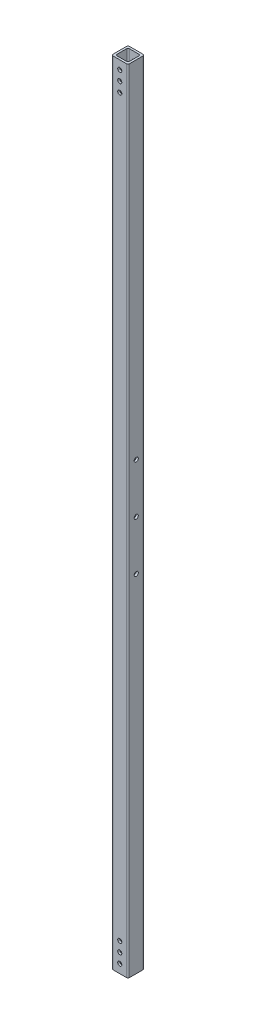
from build123d import *

# Parameters (mm, degrees)
SKETCH1_W           = 25.4
SKETCH1_H           = 25.4
SKETCH1_W_2         = 19.05
SKETCH1_H_2         = 19.05
BOSS_EXTRUDE1_DEPTH = 609.6
FILLET1_R           = 2.1082
SKETCH6_R           = 3.175
CUT_EXTRUDE5_DEPTH  = 611.261099858
SKETCH7_R           = 3.175
CUT_EXTRUDE6_DEPTH  = 611.261099858
SKETCH8_R           = 3.175
CUT_EXTRUDE7_DEPTH  = 611.261099858


with BuildPart() as part:
    # Sketch1 → Boss-Extrude1 (new, symmetric)
    with BuildSketch(Plane(origin=(0, 0, 0), x_dir=(1, 0, 0), z_dir=(0, 1, 0))):
        Rectangle(SKETCH1_W, SKETCH1_H)
        Rectangle(SKETCH1_W_2, SKETCH1_H_2, mode=Mode.SUBTRACT)
    extrude(amount=BOSS_EXTRUDE1_DEPTH, both=True)

    # Fillet1
    fillet1_edges = [part.edges().sort_by_distance(p)[0] for p in [
        (9.525, 0, 9.525),
        (9.525, 0, -9.525),
        (-9.525, 0, -9.525),
        (-9.525, 0, 9.525),
        (-12.7, 0, -12.7),
        (12.7, 0, -12.7),
        (12.7, 0, 12.7),
        (-12.7, 0, 12.7),
    ]]
    fillet(fillet1_edges, radius=FILLET1_R)

    # Sketch6 → Cut-Extrude5 (cut, through all)
    with BuildSketch(Plane(origin=(0, 0, -12.7), x_dir=(-1, 0, 0), z_dir=(0, 0, -1))):
        with Locations((0, 565.785)):
            Circle(SKETCH6_R)
        with Locations((0, 581.025)):
            Circle(SKETCH6_R)
        with Locations((0, 596.265)):
            Circle(SKETCH6_R)
    cut_extrude5 = extrude(amount=-CUT_EXTRUDE5_DEPTH, mode=Mode.SUBTRACT)

    # Sketch7 → Cut-Extrude6 (cut, through all)
    with BuildSketch(Plane.ZY.offset(12.7)):
        Circle(SKETCH7_R)
    extrude(amount=-CUT_EXTRUDE6_DEPTH, mode=Mode.SUBTRACT)

    # Sketch8 → Cut-Extrude7 (cut, through all)
    with BuildSketch(Plane.ZY.offset(12.7)):
        with Locations((0, -76.2)):
            Circle(SKETCH8_R)
    cut_extrude7 = extrude(amount=-CUT_EXTRUDE7_DEPTH, mode=Mode.SUBTRACT)

    # Mirror1: Cut-Extrude7 across plane
    add(cut_extrude7.mirror(Plane.ZX), mode=Mode.SUBTRACT)

    # Mirror2: Cut-Extrude5 across plane
    add(cut_extrude5.mirror(Plane.ZX), mode=Mode.SUBTRACT)


solid = part.part
